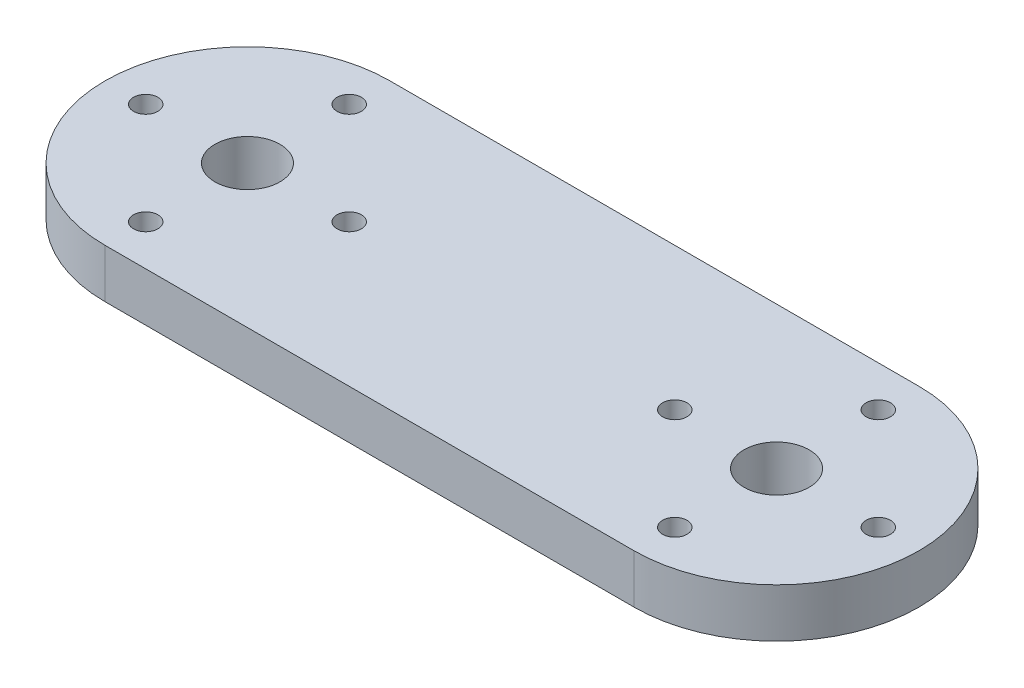
from build123d import *

# Parameters (mm, degrees)
SKETCH1_R           = 4
BOSS_EXTRUDE1_DEPTH = 6
SKETCH3_R           = 1.5
CUT_EXTRUDE1_DEPTH  = 19
SKETCH4_R           = 1.5
CUT_EXTRUDE2_DEPTH  = 19


with BuildPart() as part:
    # Sketch1 → Boss-Extrude1 (new body)
    with BuildSketch(Plane(origin=(0, 0, 0), x_dir=(1, 0, 0), z_dir=(0, 1, 0))):
        with BuildLine():
            Line((0, 17.5), (65, 17.5))
            ThreePointArc((65, 17.5), (82.5, 0), (65, -17.5))
            Line((65, -17.5), (0, -17.5))
            ThreePointArc((0, -17.5), (-17.5, 0), (0, 17.5))
        make_face()
        with Locations(Location((65, 0, 0), (0, 0, 270))):
            Circle(SKETCH1_R, mode=Mode.SUBTRACT)
        with Locations(Location((0, 0, 0), (0, 0, 270))):
            Circle(SKETCH1_R, mode=Mode.SUBTRACT)
    extrude(amount=BOSS_EXTRUDE1_DEPTH)

    # Sketch3 → Cut-Extrude1 (cut)
    with BuildSketch(Plane(origin=(0, 6, 0), x_dir=(1, 0, 0), z_dir=(0, 1, 0))):
        with Locations(Location((0, 12.5, 0), (0, 0, 270))):
            Circle(SKETCH3_R)
        with Locations(Location((12.5, 0, 0), (0, 0, 270))):
            Circle(SKETCH3_R)
        with Locations(Location((0, -12.5, 0), (0, 0, 270))):
            Circle(SKETCH3_R)
        with Locations(Location((-12.5, 0, 0), (0, 0, 270))):
            Circle(SKETCH3_R)
    extrude(amount=-CUT_EXTRUDE1_DEPTH, mode=Mode.SUBTRACT)

    # Sketch4 → Cut-Extrude2 (cut)
    with BuildSketch(Plane(origin=(0, 6, 0), x_dir=(1, 0, 0), z_dir=(0, 1, 0))):
        with Locations(Location((77.5, 0, 0), (0, 0, 270))):
            Circle(SKETCH4_R)
        with Locations(Location((65, -12.5, 0), (0, 0, 270))):
            Circle(SKETCH4_R)
        with Locations(Location((52.5, 0, 0), (0, 0, 270))):
            Circle(SKETCH4_R)
        with Locations(Location((65, 12.5, 0), (0, 0, 270))):
            Circle(SKETCH4_R)
    extrude(amount=-CUT_EXTRUDE2_DEPTH, mode=Mode.SUBTRACT)


solid = part.part
